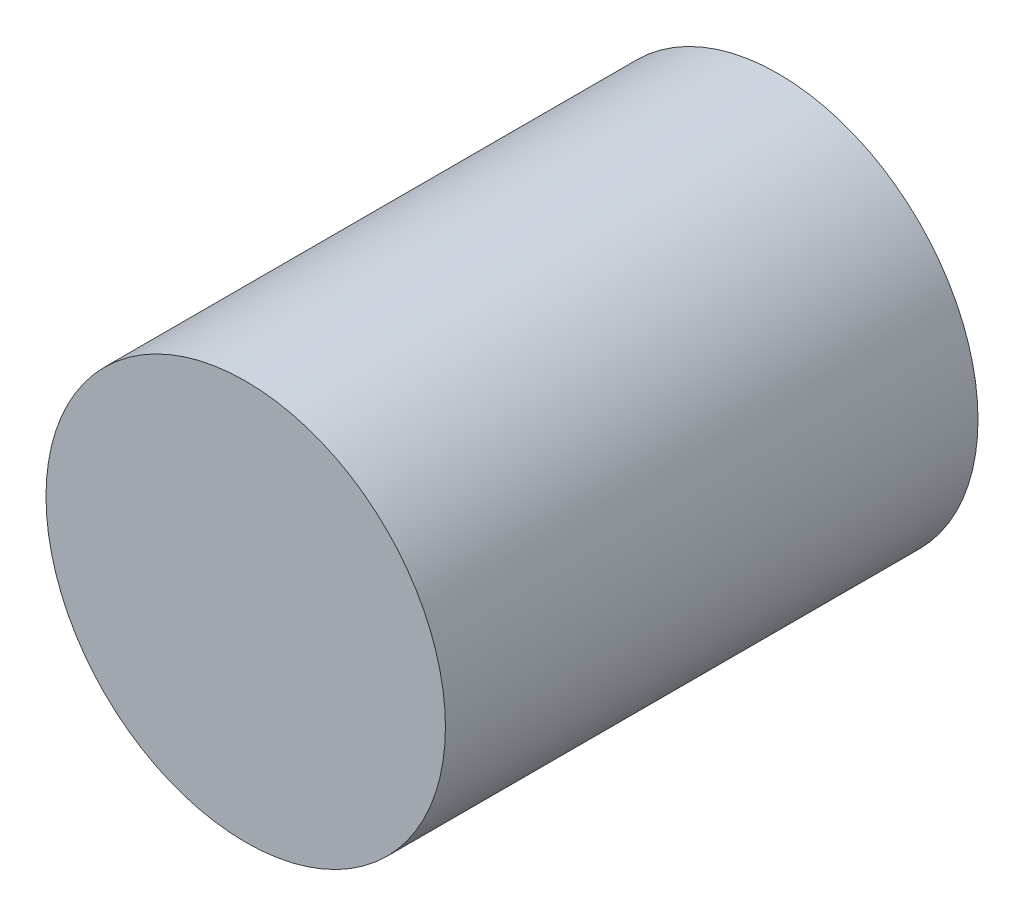
from build123d import *

# Parameters (mm, degrees)
SKETCH_1_R      = 15
EXTRUDE_1_DEPTH = 40


with BuildPart() as part:
    # 草图1 → 凸台-拉伸1 (new body)
    with BuildSketch(Plane.XY):
        Circle(SKETCH_1_R)
    extrude(amount=EXTRUDE_1_DEPTH)


solid = part.part
